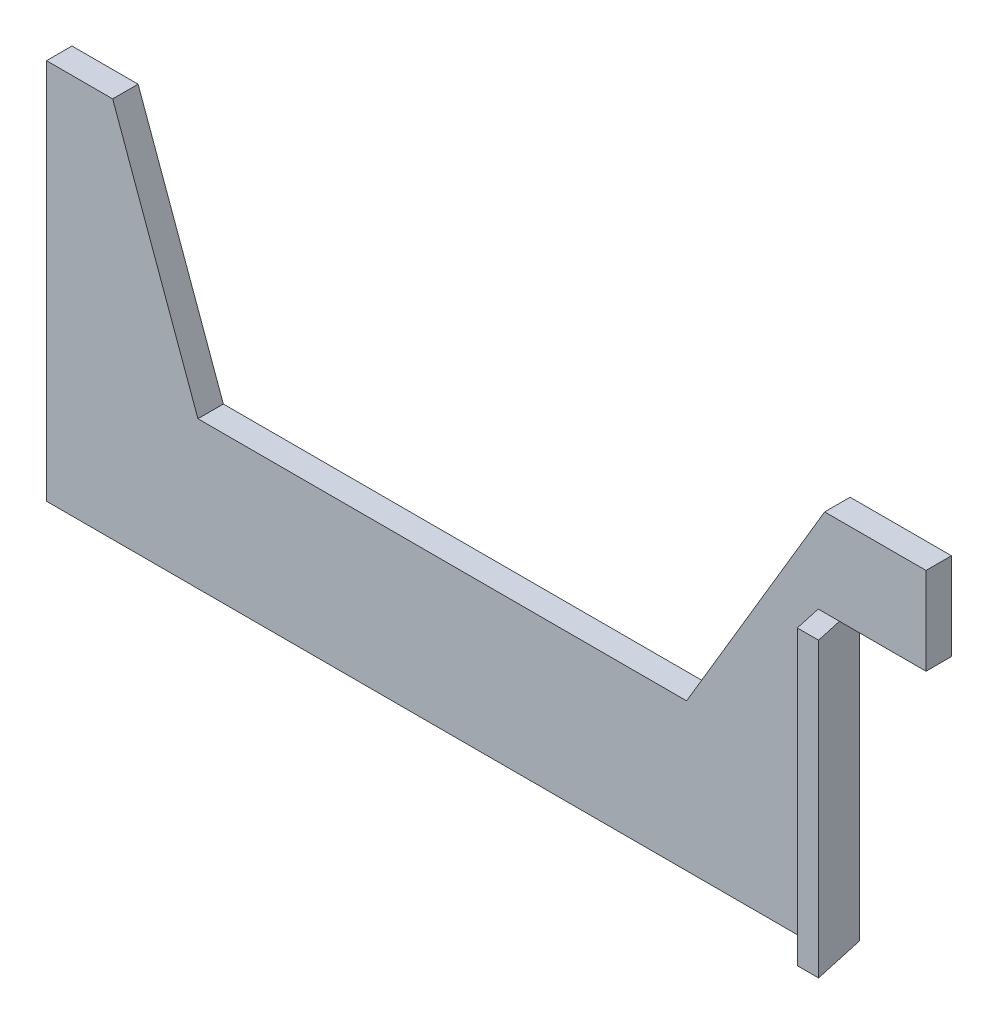
from build123d import *

# Parameters (mm, degrees)
BOSS_EXTRUDE1_DEPTH = 2
BOSS_EXTRUDE2_DEPTH = 46


with BuildPart() as part:
    # Sketch1 → Boss-Extrude1 (new, symmetric)
    with BuildSketch(Plane.XY):
        Polygon((-60.75, -30), (-60.75, 30), (-50.352877454, 30), (-36.945370579, -6.855179418), (39.897088693, -6.855179418), (61.606830496, 29.73214036), (77.549740604, 29.73214036), (77.549740604, 16), (63.049740604, 16), (63.049740604, -30), align=None)
    extrude(amount=BOSS_EXTRUDE1_DEPTH, both=True)

    # Sketch2 → Boss-Extrude2 (add)
    with BuildSketch(Plane.XZ.offset(30)):
        Polygon((63.049740604, -2), (64.873027277, 6.219294114), (61.530350142, 6.219294114), (60.59438379, 2), align=None)
    extrude(amount=-BOSS_EXTRUDE2_DEPTH)


solid = part.part
